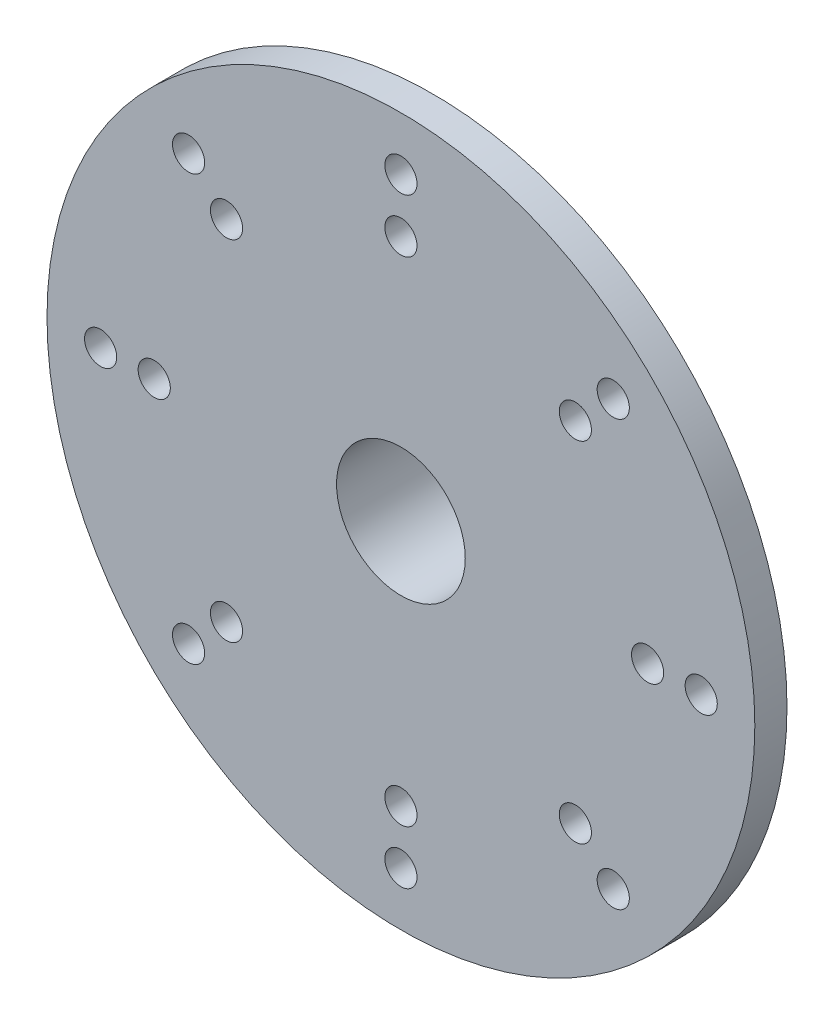
from build123d import *

# Parameters (mm, degrees)
SKETCH_1_R               = 4
SKETCH_1_R_2             = 3
EXTRUDE_1_DEPTH          = 6
EXTRUDE_START            = -1.5
SKETCH_2_R               = 16.5
SKETCH_2_R_2             = 4
EXTRUDE_2_DEPTH          = 1.5
SKETCH_4_R               = 0.75
CUT_EXTRUDE_1_DEPTH      = 1.5
PATTERN_CIRCULAR_1_COUNT = 8


with BuildPart() as part:
    # 草图1 → 凸台-拉伸1 (new body)
    with BuildSketch(Plane.XY):
        Circle(SKETCH_1_R)
        Circle(SKETCH_1_R_2, mode=Mode.SUBTRACT)
    extrude(amount=EXTRUDE_1_DEPTH)

    # 草图2 → 凸台-拉伸2 (add)
    with BuildSketch(Plane.XY.offset(6).offset(EXTRUDE_START)):
        Circle(SKETCH_2_R)
        Circle(SKETCH_2_R_2, mode=Mode.SUBTRACT)
    extrude(amount=EXTRUDE_2_DEPTH)

    # 草图4 → 切除-拉伸1 (cut)
    with BuildSketch(Plane.XY.offset(6)):
        with Locations((0, 14)):
            Circle(SKETCH_4_R)
        with Locations((0, 11.5)):
            Circle(SKETCH_4_R)
    cut_extrude_1 = extrude(amount=-CUT_EXTRUDE_1_DEPTH, mode=Mode.SUBTRACT)

    # 阵列(圆周)1: 切除-拉伸1 ×8 about axis
    pattern_circular_1_axis = Axis((0, 0, 4.5), (0, 0, 1))
    for i in range(1, PATTERN_CIRCULAR_1_COUNT):
        add(cut_extrude_1.rotate(pattern_circular_1_axis, i * 360 / PATTERN_CIRCULAR_1_COUNT), mode=Mode.SUBTRACT)


solid = part.part
